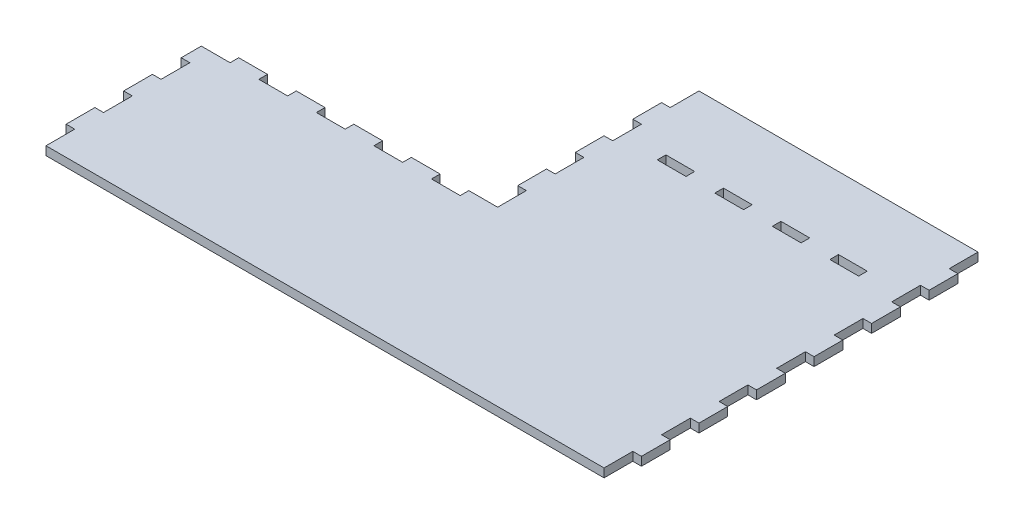
from build123d import *

# Parameters (mm, degrees)
SKETCH1_W           = 200
SKETCH1_H           = 130
BOSS_EXTRUDE1_DEPTH = 3
SKETCH2_W           = 97
SKETCH2_H           = 70
CUT_EXTRUDE1_DEPTH  = 120.306328416
SKETCH3_W           = 3
SKETCH3_H           = 10
CUT_EXTRUDE2_DEPTH  = 120.306328416
LPATTERN1_COUNT     = 3
LPATTERN1_PITCH     = 20
SKETCH4_W           = 3
SKETCH4_H           = 10
CUT_EXTRUDE3_DEPTH  = 120.306328416
LPATTERN2_COUNT     = 7
LPATTERN2_PITCH     = 20
SKETCH5_W           = 3
SKETCH5_H           = 10
CUT_EXTRUDE4_DEPTH  = 120.306328416
LPATTERN3_COUNT     = 4
LPATTERN3_PITCH     = 20
SKETCH7_W           = 10
SKETCH7_H           = 3
CUT_EXTRUDE7_DEPTH  = 120.306328416
LPATTERN6_COUNT     = 5
LPATTERN6_PITCH     = 20
SKETCH8_W           = 10
SKETCH8_H           = 3
CUT_EXTRUDE8_DEPTH  = 120.306328416
LPATTERN8_COUNT     = 4
LPATTERN8_PITCH     = 20


with BuildPart() as part:
    # Sketch1 → Boss-Extrude1 (new body)
    with BuildSketch(Plane(origin=(0, 0, 0), x_dir=(1, 0, 0), z_dir=(0, 1, 0))):
        Rectangle(SKETCH1_W, SKETCH1_H)
    extrude(amount=BOSS_EXTRUDE1_DEPTH)

    # Sketch2 → Cut-Extrude1 (cut, through all)
    with BuildSketch(Plane(origin=(0, 3, 0), x_dir=(1, 0, 0), z_dir=(0, 1, 0))):
        with Locations((-51.5, 30)):
            Rectangle(SKETCH2_W, SKETCH2_H)
    extrude(amount=-CUT_EXTRUDE1_DEPTH, mode=Mode.SUBTRACT)

    # Sketch3 → Cut-Extrude2 (cut, through all)
    with BuildSketch(Plane(origin=(0, 3, 0), x_dir=(1, 0, 0), z_dir=(0, 1, 0))):
        with Locations((-98.5, -60)):
            Rectangle(SKETCH3_W, SKETCH3_H)
    cut_extrude2 = extrude(amount=-CUT_EXTRUDE2_DEPTH, mode=Mode.SUBTRACT)

    # LPattern1: Cut-Extrude2 ×3
    with Locations(*[(0, 0, -i * LPATTERN1_PITCH) for i in range(1, LPATTERN1_COUNT)]):
        add(cut_extrude2, mode=Mode.SUBTRACT)

    # Sketch4 → Cut-Extrude3 (cut, through all)
    with BuildSketch(Plane(origin=(0, 3, 0), x_dir=(1, 0, 0), z_dir=(0, 1, 0))):
        with Locations((98.5, -60)):
            Rectangle(SKETCH4_W, SKETCH4_H)
    cut_extrude3 = extrude(amount=-CUT_EXTRUDE3_DEPTH, mode=Mode.SUBTRACT)

    # LPattern2: Cut-Extrude3 ×7
    with Locations(*[(0, 0, -i * LPATTERN2_PITCH) for i in range(1, LPATTERN2_COUNT)]):
        add(cut_extrude3, mode=Mode.SUBTRACT)

    # Sketch5 → Cut-Extrude4 (cut, through all)
    with BuildSketch(Plane(origin=(0, 3, 0), x_dir=(1, 0, 0), z_dir=(0, 1, 0))):
        with Locations((-1.5, 60)):
            Rectangle(SKETCH5_W, SKETCH5_H)
    cut_extrude4 = extrude(amount=-CUT_EXTRUDE4_DEPTH, mode=Mode.SUBTRACT)

    # LPattern3: Cut-Extrude4 ×4
    with Locations(*[(0, 0, i * LPATTERN3_PITCH) for i in range(1, LPATTERN3_COUNT)]):
        add(cut_extrude4, mode=Mode.SUBTRACT)

    # Sketch7 → Cut-Extrude7 (cut, through all)
    with BuildSketch(Plane(origin=(0, 3, 0), x_dir=(1, 0, 0), z_dir=(0, 1, 0))):
        with Locations((-15, -6.5)):
            Rectangle(SKETCH7_W, SKETCH7_H)
    cut_extrude7 = extrude(amount=-CUT_EXTRUDE7_DEPTH, mode=Mode.SUBTRACT)

    # LPattern6: Cut-Extrude7 ×5
    with Locations(*[(-i * LPATTERN6_PITCH, 0, 0) for i in range(1, LPATTERN6_COUNT)]):
        add(cut_extrude7, mode=Mode.SUBTRACT)

    # Sketch8 → Cut-Extrude8 (cut, through all)
    with BuildSketch(Plane(origin=(0, 3, 0), x_dir=(1, 0, 0), z_dir=(0, 1, 0))):
        with Locations((78.5, 38.5)):
            Rectangle(SKETCH8_W, SKETCH8_H)
    cut_extrude8 = extrude(amount=-CUT_EXTRUDE8_DEPTH, mode=Mode.SUBTRACT)

    # LPattern8: Cut-Extrude8 ×4
    with Locations(*[(-i * LPATTERN8_PITCH, 0, 0) for i in range(1, LPATTERN8_COUNT)]):
        add(cut_extrude8, mode=Mode.SUBTRACT)


solid = part.part
